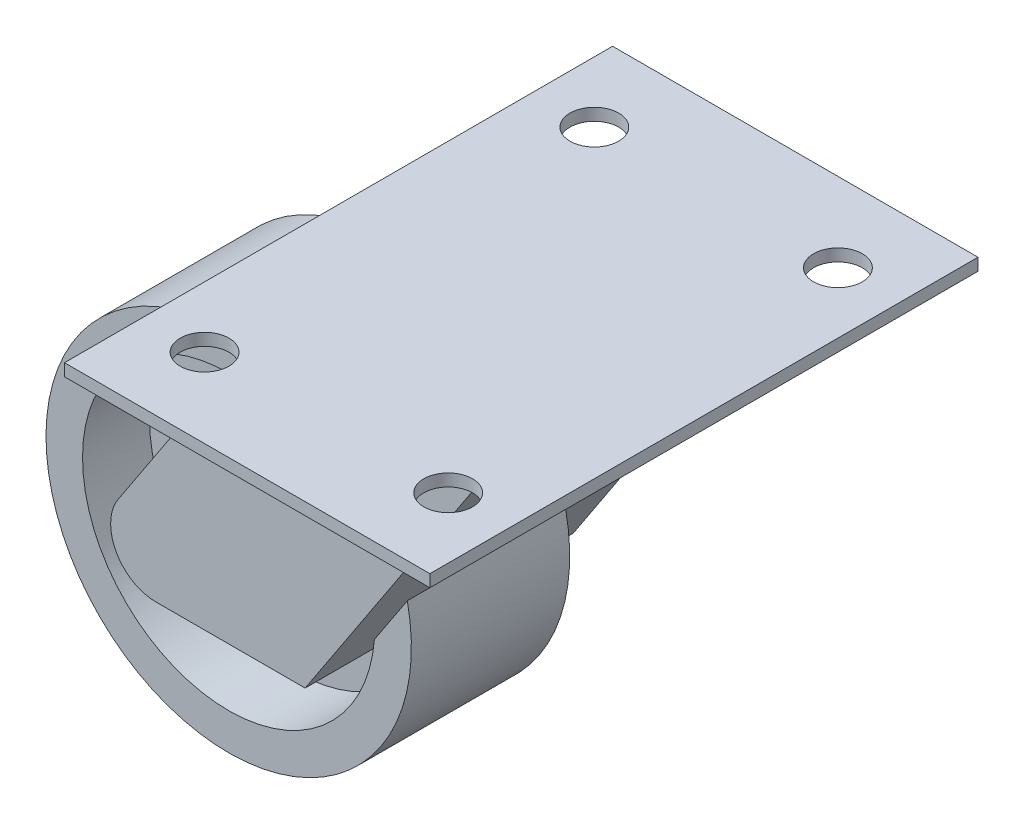
from build123d import *

# Parameters (mm, degrees)
CROQUIS1_R              = 15
CROQUIS1_R_2            = 12
EXTRUIR_L_MINA1_DEPTH   = 6.5
CROQUIS2_R              = 5
SALIENTE_EXTRUIR1_DEPTH = 6.5
CROQUIS3_R              = 12.5
SALIENTE_EXTRUIR2_DEPTH = 1
CROQUIS4_R              = 2
SALIENTE_EXTRUIR3_DEPTH = 11
SALIENTE_EXTRUIR4_DEPTH = 22
CROQUIS9_W              = 30
CROQUIS9_H              = 45
CROQUIS9_R              = 2
SALIENTE_EXTRUIR5_DEPTH = 1


with BuildPart() as part:
    # Croquis1 → Extruir-Lámina1 (new, symmetric)
    with BuildSketch(Plane.XY):
        Circle(CROQUIS1_R)
        Circle(CROQUIS1_R_2, mode=Mode.SUBTRACT)
    extrude(amount=EXTRUIR_L_MINA1_DEPTH, both=True)



with BuildPart() as body_2:
    # Croquis2 → Saliente-Extruir1 (new, symmetric)
    with BuildSketch(Plane.XY):
        with Locations(Location((0, 0, 0), (0, 0, 180))):
            Circle(CROQUIS2_R)
    extrude(amount=SALIENTE_EXTRUIR1_DEPTH, both=True)


with BuildPart() as part_1:
    add(part.part)

    add(body_2.part)  # Saliente-Extruir2 merges body 2
    # Croquis3 → Saliente-Extruir2 (add, symmetric)
    with BuildSketch(Plane.XY):
        Circle(CROQUIS3_R)
    extrude(amount=SALIENTE_EXTRUIR2_DEPTH, both=True)

    # Croquis4 → Saliente-Extruir3 (add, symmetric)
    with BuildSketch(Plane.XY):
        Circle(CROQUIS4_R)
    extrude(amount=SALIENTE_EXTRUIR3_DEPTH, both=True)

    # Croquis6 → Saliente-Extruir4 (add, through all)
    with BuildSketch(Plane.XY.offset(11)):
        with BuildLine():
            Line((-4.581858608, 2.977952867), (7.949667258, 22))
            Line((7.949667258, 22), (27.086339579, 22))
            Line((27.086339579, 22), (10.776903307, -2.756671198))
            Line((10.776903307, -2.756671198), (-1.492562871, -2.756671198))
            ThreePointArc((-1.492562871, -2.756671198), (-4.749465591, -0.811766904), (-4.581858608, 2.977952867))
        make_face()
    extrude(amount=-SALIENTE_EXTRUIR4_DEPTH)

    # Croquis9 → Saliente-Extruir5 (add)
    with BuildSketch(Plane(origin=(0, 22, 0), x_dir=(1, 0, 0), z_dir=(0, 1, 0))):
        with Locations((17.519667258, 0)):
            Rectangle(CROQUIS9_W, CROQUIS9_H)
        with Locations(Location((27.519667258, 16, 0), (0, 0, 270))):
            Circle(CROQUIS9_R, mode=Mode.SUBTRACT)
        with Locations(Location((7.519667258, 16, 0), (0, 0, 90))):
            Circle(CROQUIS9_R, mode=Mode.SUBTRACT)
        with Locations(Location((7.519667258, -16, 0), (0, 0, 270))):
            Circle(CROQUIS9_R, mode=Mode.SUBTRACT)
        with Locations(Location((27.519667258, -16, 0), (0, 0, 90))):
            Circle(CROQUIS9_R, mode=Mode.SUBTRACT)
    extrude(amount=-SALIENTE_EXTRUIR5_DEPTH)


solid = part_1.part
